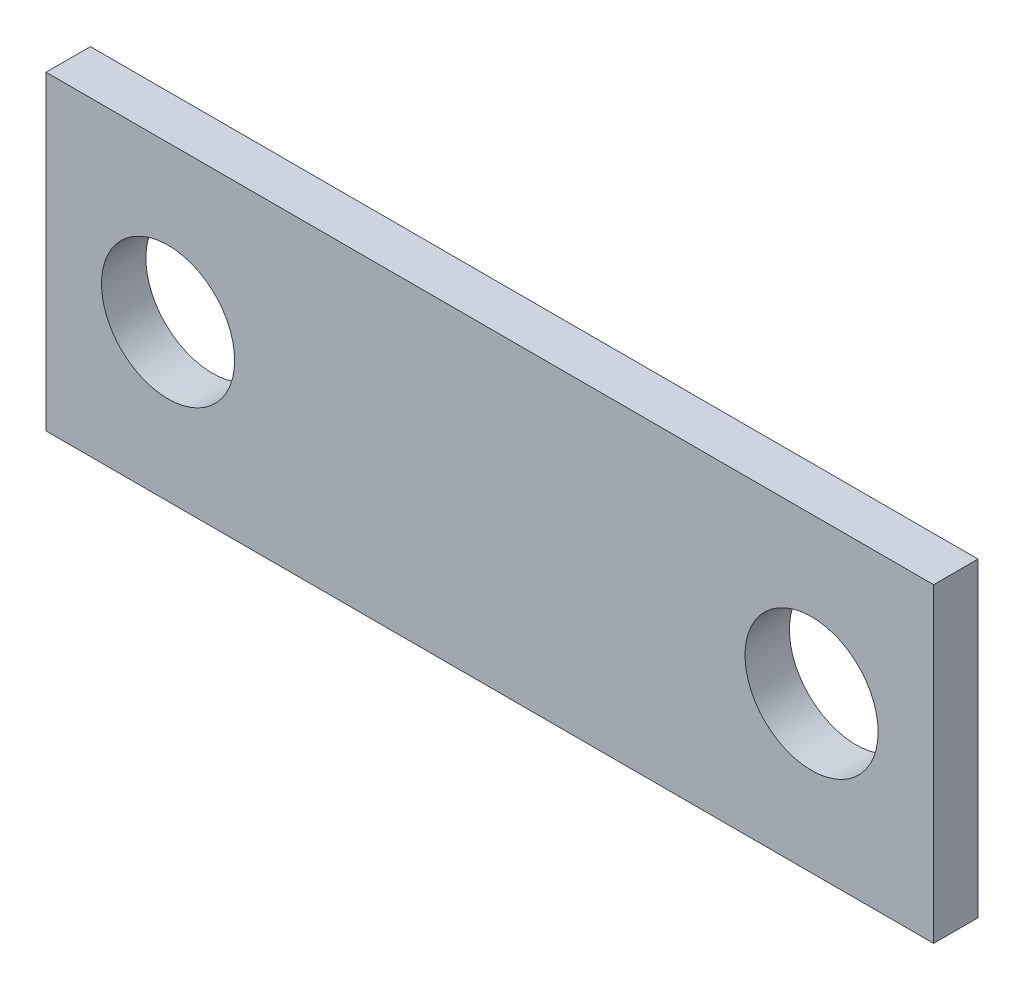
from build123d import *

# Parameters (mm, degrees)
SKETCH1_W           = 20
SKETCH1_H           = 7
BOSS_EXTRUDE1_DEPTH = 1
SKETCH2_R           = 1.5
CUT_EXTRUDE1_DEPTH  = 1


with BuildPart() as part:
    # Sketch1 → Boss-Extrude1 (new body)
    with BuildSketch(Plane.XY):
        Rectangle(SKETCH1_W, SKETCH1_H)
    extrude(amount=BOSS_EXTRUDE1_DEPTH)

    # Sketch2 → Cut-Extrude1 (cut)
    with BuildSketch(Plane.XY.offset(1)):
        with Locations((-7.25, 0)):
            Circle(SKETCH2_R)
        with Locations((7.25, 0)):
            Circle(SKETCH2_R)
    extrude(amount=-CUT_EXTRUDE1_DEPTH, mode=Mode.SUBTRACT)


solid = part.part
